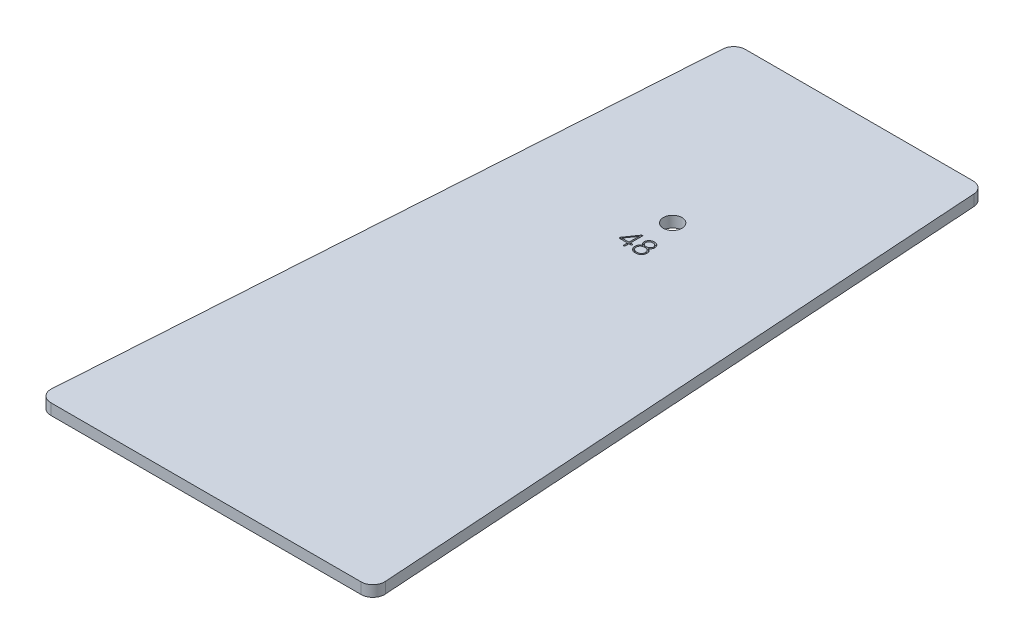
from build123d import *

# Parameters (mm, degrees)
BOSS_EXTRUDE1_DEPTH = 5.9944
SKETCH2_R           = 5.08
CUT_EXTRUDE1_DEPTH  = 368.170623747
CUT_EXTRUDE2_DEPTH  = 1.27
FILLET1_R           = 6.35


with BuildPart() as part:
    # Sketch1 → Boss-Extrude1 (new body)
    with BuildSketch(Plane(origin=(0, 0, 0), x_dir=(1, 0, 0), z_dir=(0, 1, 0))):
        Polygon((-67.945, 0), (67.945, 0), (91.252255377, -355.6), (-91.252255377, -355.6), align=None)
    extrude(amount=BOSS_EXTRUDE1_DEPTH)

    # Sketch2 → Cut-Extrude1 (cut, through all)
    with BuildSketch(Plane(origin=(0, 5.9944, 0), x_dir=(1, 0, 0), z_dir=(0, 1, 0))):
        with Locations(Location((0, -101.6, 0), (0, 0, 270))):
            Circle(SKETCH2_R)
    extrude(amount=-CUT_EXTRUDE1_DEPTH, mode=Mode.SUBTRACT)

    # Sketch3 → Cut-Extrude2 (cut)
    # profile 1 of 2: a face of its own
    with BuildSketch(Plane(origin=(0, 5.9944, 0), x_dir=(1, 0, 0), z_dir=(0, 1, 0))):
        Polygon((-0.64745098, -123.339411765), (-2.041960784, -123.339411765), (-2.041960784, -125.73), (-2.838823529, -125.73), (-2.838823529, -123.339411765), (-7.420784314, -123.339411765), (-7.420784314, -122.54254902), (-2.676960784, -115.769215686), (-2.041960784, -115.769215686), (-2.041960784, -122.54254902), (-0.64745098, -122.54254902), align=None)
        Polygon((-2.838823529, -122.54254902), (-2.838823529, -117.185514706), (-6.589681373, -122.54254902), align=None, mode=Mode.SUBTRACT)
    # profile 2 of 2: a face of its own
    with BuildSketch(Plane(origin=(0, 5.9944, 0), x_dir=(1, 0, 0), z_dir=(0, 1, 0))):
        with BuildLine():
            add(Edge.make_bspline(
                [(2.583578431, -120.288921569), (2.469757768, -120.233881465), (2.249012298, -120.12713588), (1.956518664, -119.921342429), (1.702152679, -119.699076506), (1.501146738, -119.44377738), (1.338617892, -119.168616459), (1.228149162, -118.865639865), (1.155782886, -118.539856671), (1.148992832, -118.313778727), (1.145490196, -118.197156863)],
                knots=[0, 0, 0, 0, 1.121505956, 2.175065151, 3.167266929, 4.111724904, 5.049364576, 5.994542137, 6.965488487, 8, 8, 8, 8], degree=3))
            add(Edge.make_bspline(
                [(1.145490196, -118.197156863), (1.150650446, -118.072365116), (1.160750204, -117.828119903), (1.228851738, -117.472785505), (1.349283719, -117.141800757), (1.514672213, -116.835914328), (1.722446411, -116.558323216), (1.961706137, -116.307792449), (2.237618257, -116.091502351), (2.542166789, -115.903299875), (2.878819269, -115.755673627), (3.240549794, -115.643784068), (3.628448984, -115.583063263), (3.894888198, -115.574417097), (4.031004902, -115.57)],
                knots=[0, 0, 0, 0, 1.029797524, 2.015542871, 2.97168719, 3.925682005, 4.874436321, 5.825197768, 6.775997772, 7.759919145, 8.771905717, 9.801204739, 10.876694018, 12, 12, 12, 12], degree=3))
            add(Edge.make_bspline(
                [(4.031004902, -115.57), (4.168265453, -115.573915681), (4.437144184, -115.581586081), (4.826482227, -115.649360813), (5.193306386, -115.752803643), (5.528540282, -115.908692567), (5.837903626, -116.092702905), (6.1102298, -116.31471085), (6.35377186, -116.560126292), (6.554706316, -116.839931798), (6.724312123, -117.141452673), (6.837039409, -117.474041466), (6.912766198, -117.827458116), (6.919373101, -118.072230943), (6.922745098, -118.197156863)],
                knots=[0, 0, 0, 0, 1.129990317, 2.213530109, 3.246876235, 4.260696229, 5.250296002, 6.204863837, 7.14791721, 8.090040244, 9.034951547, 9.986644228, 10.972433637, 12, 12, 12, 12], degree=3))
            add(Edge.make_bspline(
                [(6.922745098, -118.197156863), (6.919216595, -118.313762788), (6.912376396, -118.539809833), (6.840365414, -118.865811955), (6.728782095, -119.16750517), (6.571087227, -119.445784939), (6.365570739, -119.697892228), (6.112007529, -119.921560928), (5.819142842, -120.127075675), (5.598450258, -120.233860983), (5.484656863, -120.288921569)],
                knots=[0, 0, 0, 0, 1.034356649, 2.00515765, 2.950193721, 3.883105322, 4.833207204, 5.825260452, 6.878661931, 8, 8, 8, 8], degree=3))
            add(Edge.make_bspline(
                [(5.484656863, -120.288921569), (5.629584904, -120.345274008), (5.909015189, -120.453925018), (6.287487251, -120.674211509), (6.609031926, -120.93355376), (6.873327893, -121.233567804), (7.075041903, -121.576427985), (7.218061472, -121.958672451), (7.307398658, -122.379704945), (7.316483523, -122.673858557), (7.321176471, -122.825808824)],
                knots=[0, 0, 0, 0, 1.104307536, 2.129173671, 3.099289652, 4.029922044, 4.956040619, 5.91100379, 6.920891952, 8, 8, 8, 8], degree=3))
            add(Edge.make_bspline(
                [(7.321176471, -122.825808824), (7.318321613, -122.949426035), (7.312758231, -123.190324178), (7.265802022, -123.539824084), (7.187729342, -123.864910338), (7.08225254, -124.169001718), (6.941227364, -124.448040534), (6.773245337, -124.7078841), (6.567526726, -124.937879056), (6.337999195, -125.1468091), (6.085093931, -125.326864216), (5.825207776, -125.49131202), (5.550637227, -125.624540533), (5.268662499, -125.738439853), (4.972715633, -125.821171296), (4.668146304, -125.883957252), (4.352586022, -125.922213573), (4.139017278, -125.926863823), (4.031004902, -125.929215686)],
                knots=[0, 0, 0, 0, 1.165158113, 2.270593413, 3.316967265, 4.313258111, 5.297614584, 6.258105811, 7.221631145, 8.198179015, 9.17849254, 10.144943439, 11.094310651, 12.051658199, 13.00840578, 13.986862741, 14.981855988, 16, 16, 16, 16], degree=3))
            add(Edge.make_bspline(
                [(4.031004902, -125.929215686), (3.875058258, -125.925696781), (3.571935445, -125.918856875), (3.134122695, -125.846848764), (2.72518677, -125.740751294), (2.34901118, -125.583969435), (2.003278658, -125.380987257), (1.698555205, -125.12058817), (1.419046499, -124.819504607), (1.183989068, -124.46822424), (0.986969857, -124.087207102), (0.851225779, -123.680518964), (0.762222762, -123.259231693), (0.752157029, -122.971528144), (0.747058824, -122.825808824)],
                knots=[0, 0, 0, 0, 1.105131574, 2.1481103, 3.138917951, 4.095657432, 5.029651657, 5.970060793, 6.928497124, 7.934844507, 8.958454957, 9.961540876, 10.967538361, 12, 12, 12, 12], degree=3))
            add(Edge.make_bspline(
                [(0.747058824, -122.825808824), (0.750958552, -122.681150729), (0.75854413, -122.399768191), (0.842695471, -121.995459368), (0.973276047, -121.622346822), (1.158365157, -121.279786493), (1.410049218, -120.969502557), (1.737856358, -120.703220915), (2.131081537, -120.465798713), (2.427881476, -120.34978217), (2.583578431, -120.288921569)],
                knots=[0, 0, 0, 0, 1.026535231, 1.996771007, 2.920245165, 3.827596735, 4.74995178, 5.739273443, 6.81405554, 8, 8, 8, 8], degree=3))
        make_face()
        with BuildLine():
            add(Edge.make_bspline(
                [(6.125882353, -118.228284314), (6.123712551, -118.138717354), (6.119482737, -117.964115492), (6.062504916, -117.712266336), (5.98038969, -117.47610598), (5.859680999, -117.260408538), (5.712107035, -117.063654994), (5.541353334, -116.884667003), (5.342009506, -116.731408764), (5.12047127, -116.600704242), (4.877544231, -116.494065356), (4.612645581, -116.419299497), (4.328142503, -116.37607471), (4.131800472, -116.369987645), (4.031004902, -116.366862745)],
                knots=[0, 0, 0, 0, 1.025357551, 1.998832358, 2.947617169, 3.885211583, 4.820763882, 5.76355694, 6.713535567, 7.695415045, 8.708191046, 9.748023335, 10.843908909, 12, 12, 12, 12], degree=3))
            add(Edge.make_bspline(
                [(4.031004902, -116.366862745), (3.930115428, -116.369479246), (3.734451772, -116.374553651), (3.45109005, -116.424626768), (3.184332955, -116.495249758), (2.942679865, -116.608198219), (2.718840309, -116.735817229), (2.525804645, -116.895504967), (2.351663826, -117.06954252), (2.205860677, -117.266948572), (2.084614049, -117.480848146), (2.006076015, -117.716918532), (1.948805302, -117.966145907), (1.944532402, -118.139739939), (1.942352941, -118.228284314)],
                knots=[0, 0, 0, 0, 1.159100913, 2.247944337, 3.301963364, 4.322203238, 5.306638987, 6.257145066, 7.193841607, 8.131829567, 9.071864958, 10.007877085, 10.983886281, 12, 12, 12, 12], degree=3))
            add(Edge.make_bspline(
                [(1.942352941, -118.228284314), (1.949031284, -118.351609409), (1.962012851, -118.591332492), (2.078543183, -118.932570023), (2.275975601, -119.230977841), (2.538899021, -119.489874585), (2.859494616, -119.695110648), (3.219184028, -119.847237085), (3.614969422, -119.934652524), (3.889465343, -119.946589818), (4.031004902, -119.952745098)],
                knots=[0, 0, 0, 0, 0.976469849, 1.898091887, 2.820632736, 3.792824454, 4.804409425, 5.822739039, 6.877329201, 8, 8, 8, 8], degree=3))
            add(Edge.make_bspline(
                [(4.031004902, -119.952745098), (4.173676734, -119.947027996), (4.449626377, -119.935970226), (4.845443805, -119.843138475), (5.205858473, -119.692440852), (5.5262161, -119.485656096), (5.792340565, -119.229006795), (5.989565911, -118.929321811), (6.105911534, -118.589249373), (6.119116744, -118.350570163), (6.125882353, -118.228284314)],
                knots=[0, 0, 0, 0, 1.129790696, 2.185191953, 3.202539324, 4.213148559, 5.190270146, 6.111921147, 7.032654223, 8, 8, 8, 8], degree=3))
        make_face(mode=Mode.SUBTRACT)
        with BuildLine():
            add(Edge.make_bspline(
                [(6.524313725, -122.891176471), (6.520920106, -122.784069548), (6.514346152, -122.576587224), (6.457940803, -122.276145516), (6.360243009, -122.001268427), (6.229636966, -121.747680515), (6.058383341, -121.524547206), (5.861403172, -121.319861355), (5.625352542, -121.150730147), (5.361894512, -121.006677276), (5.069527463, -120.890509463), (4.748625434, -120.807841497), (4.399931987, -120.756977985), (4.158809369, -120.752120035), (4.034117647, -120.749607843)],
                knots=[0, 0, 0, 0, 1.039609951, 2.013881847, 2.953999013, 3.864434323, 4.771294027, 5.676192345, 6.613334877, 7.578339998, 8.586868343, 9.659784589, 10.789804577, 12, 12, 12, 12], degree=3))
            add(Edge.make_bspline(
                [(4.034117647, -120.749607843), (3.909429768, -120.752131017), (3.668314581, -120.757010204), (3.319569101, -120.807725005), (2.99791307, -120.891154926), (2.704071746, -121.0060513), (2.440098851, -121.149817241), (2.206601469, -121.320933406), (2.00975895, -121.524422815), (1.838623351, -121.747713983), (1.707985337, -122.001259134), (1.610296441, -122.276148125), (1.553888608, -122.576586511), (1.547315006, -122.784069305), (1.543921569, -122.891176471)],
                knots=[0, 0, 0, 0, 1.210068076, 2.339969154, 3.412772499, 4.430563009, 5.395466584, 6.324404951, 7.229208048, 8.135972324, 9.046311831, 9.98633007, 10.960499445, 12, 12, 12, 12], degree=3))
            add(Edge.make_bspline(
                [(1.543921569, -122.891176471), (1.544985709, -122.975375962), (1.547058013, -123.139345961), (1.584332291, -123.377568996), (1.635643144, -123.60328801), (1.710828263, -123.816382724), (1.807662765, -124.01525168), (1.923393036, -124.202835216), (2.065441305, -124.372501414), (2.222512089, -124.532765628), (2.401927227, -124.670707654), (2.59105853, -124.797903891), (2.798953829, -124.900320608), (3.020681135, -124.982957849), (3.253996345, -125.05338774), (3.502487363, -125.098599125), (3.763661295, -125.12731722), (3.942730319, -125.130651369), (4.034117647, -125.132352941)],
                knots=[0, 0, 0, 0, 1.068010984, 2.079843423, 3.054621512, 4.004777055, 4.941776883, 5.859399066, 6.795750163, 7.746088411, 8.702980793, 9.664127459, 10.636408857, 11.637286391, 12.667146169, 13.726670379, 14.839813183, 16, 16, 16, 16], degree=3))
            add(Edge.make_bspline(
                [(4.034117647, -125.132352941), (4.125501134, -125.13064464), (4.304562631, -125.127297307), (4.56680524, -125.098562307), (4.815810816, -125.052774976), (5.050277608, -124.987318412), (5.270990902, -124.903366885), (5.475354786, -124.796869735), (5.667389124, -124.674485413), (5.845554591, -124.535609475), (6.002838181, -124.375684848), (6.144831297, -124.205929646), (6.260573544, -124.018369128), (6.357414326, -123.819495237), (6.432561156, -123.606396774), (6.484253282, -123.379696319), (6.520966694, -123.140347845), (6.523182823, -122.975367067), (6.524313725, -122.891176471)],
                knots=[0, 0, 0, 0, 1.159544989, 2.272071989, 3.343950718, 4.369611888, 5.357637803, 6.335341631, 7.288798869, 8.245161887, 9.194974397, 10.130807493, 11.047922037, 11.984403507, 12.934033413, 13.908272243, 14.932579852, 16, 16, 16, 16], degree=3))
        make_face(mode=Mode.SUBTRACT)
    extrude(amount=-CUT_EXTRUDE2_DEPTH, mode=Mode.SUBTRACT)

    # Fillet1
    fillet1_edges = [part.edges().sort_by_distance(p)[0] for p in [
        (91.252255377, 2.9972, 355.6),
        (-91.252255377, 2.9972, 355.6),
        (-67.945, 2.9972, 0),
        (67.945, 2.9972, 0),
    ]]
    fillet(fillet1_edges, radius=FILLET1_R)


solid = part.part
